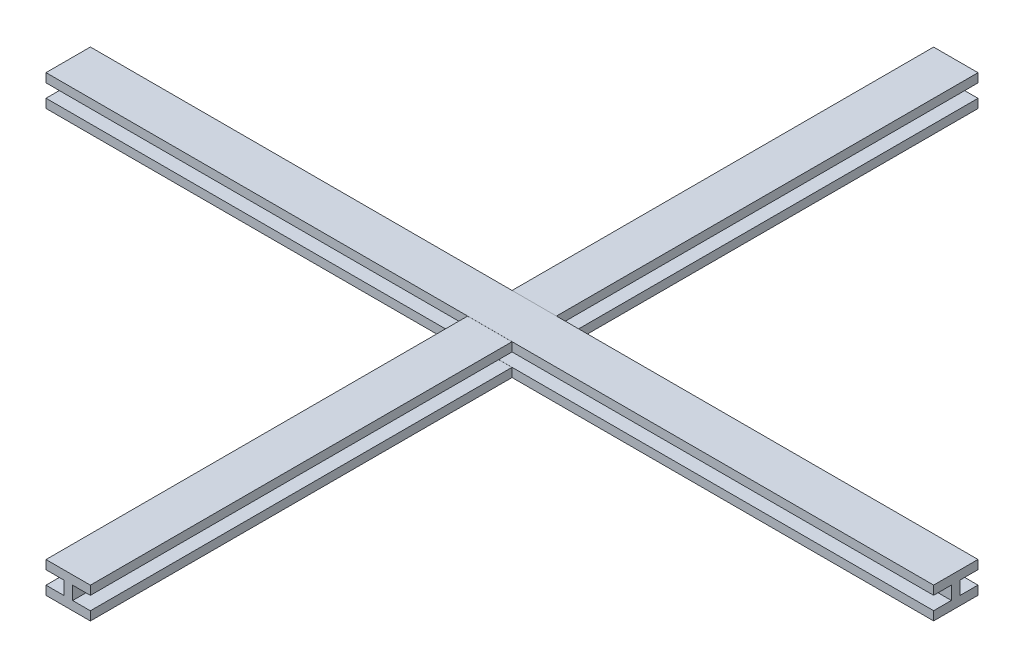
from build123d import *

# Parameters (mm, degrees)
BOSS_EXTRUDE1_DEPTH      = 1000
BOSS_EXTRUDE1_DEPTH_BACK = 1000
BOSS_EXTRUDE2_DEPTH      = 1000
BOSS_EXTRUDE2_DEPTH_BACK = 1000


with BuildPart() as part:
    # Sketch1 → Boss-Extrude1 (new, two sides: drawn at the far end of the back side and taken through both)
    with BuildSketch(Plane.XY.offset(-BOSS_EXTRUDE1_DEPTH_BACK)):
        Polygon((10, 15), (50, 15), (50, 35), (-50, 35), (-50, 15), (-10, 15), (-10, -15), (-50, -15), (-50, -35), (50, -35), (50, -15), (10, -15), align=None)
    extrude(amount=BOSS_EXTRUDE1_DEPTH + BOSS_EXTRUDE1_DEPTH_BACK)

    # Sketch2 → Boss-Extrude2 (add, two sides: drawn at the far end of the back side and taken through both)
    with BuildSketch(Plane(origin=(0, 0, 0), x_dir=(0, 0, -1), z_dir=(1, 0, 0)).offset(-BOSS_EXTRUDE2_DEPTH_BACK)):
        Polygon((10, 15.14982009), (50, 15.14982009), (50, 35.14982009), (-50, 35.14982009), (-50, 15.14982009), (-10, 15.14982009), (-10, -14.85017991), (-50, -14.85017991), (-50.000001017, -34.85017991), (49.999998983, -34.85017991), (50, -14.85017991), (10, -14.85017991), align=None)
    extrude(amount=BOSS_EXTRUDE2_DEPTH + BOSS_EXTRUDE2_DEPTH_BACK)


solid = part.part
